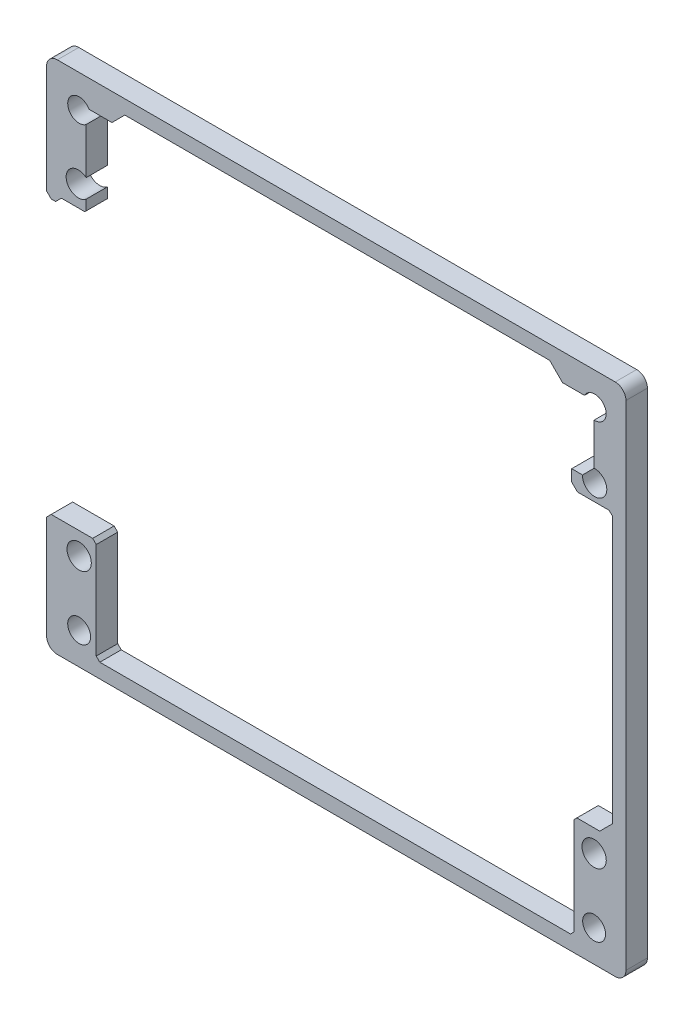
from build123d import *

# Parameters (mm, degrees)
MODEL_R                 = 1.600279216
MODEL_R_2               = 1.7
SALIENTE_EXTRUIR2_DEPTH = 3


with BuildPart() as part:
    # Model → Saliente-Extruir2 (new body)
    with BuildSketch(Plane.XY):
        with BuildLine():
            Line((271.351226454, 245.262259879), (270.71262235, 244.623655775))
            Line((270.71262235, 244.623655775), (270.71262235, 230.233550186))
            ThreePointArc((270.71262235, 230.233550186), (271.151962178, 229.172890015), (272.21262235, 228.733550186))
            Line((272.21262235, 228.733550186), (350.217232207, 228.733550186))
            ThreePointArc((350.217232207, 228.733550186), (351.277892379, 229.172890015), (351.717232207, 230.233550186))
            Line((351.717232207, 230.233550186), (351.717232207, 299.235954421))
            ThreePointArc((351.717232208, 299.235954421), (351.277892379, 300.296614592), (350.217232207, 300.735954421))
            Line((350.217232207, 300.735954421), (272.21262235, 300.735954421))
            ThreePointArc((272.21262235, 300.735954421), (271.151962178, 300.296614592), (270.71262235, 299.235954421))
            Line((270.71262235, 299.235954421), (270.71262235, 284.103268217))
            Line((270.71262235, 284.103268217), (271.351226454, 283.464664113))
            Line((271.351226454, 283.464664113), (271.97853318, 283.464664113))
            Line((271.97853318, 283.464664113), (272.77853318, 284.264664113))
            Line((272.77853318, 284.264664113), (276.051226454, 284.264664113))
            Line((276.051226454, 284.264664113), (276.251226454, 284.464664114))
            Line((276.251226454, 284.464664114), (276.251226454, 285.894852324))
            ThreePointArc((276.251226454, 285.894852324), (273.443758266, 287.176917482), (276.239508411, 288.48433854))
            Line((276.239508411, 288.48433854), (276.239508411, 294.917021597))
            ThreePointArc((276.239508411, 294.917021597), (273.696009795, 296.507802753), (276.661013605, 296.964664113))
            Line((276.661013605, 296.964664113), (279.851226454, 296.964664113))
            Line((279.851226454, 296.964664113), (281.651226454, 298.764664113))
            Line((281.651226454, 298.764664113), (341.055836311, 298.764664113))
            Line((341.055836311, 298.764664113), (342.855836311, 296.964664113))
            Line((342.855836311, 296.964664113), (345.9273642, 296.964664113))
            ThreePointArc((345.9273642, 296.964664113), (348.738416986, 297.034405979), (347.268369224, 294.637357529))
            Line((347.268369224, 294.637357529), (347.268369224, 288.812692031))
            ThreePointArc((347.268369224, 288.812692031), (348.543864828, 285.912196427), (345.643369224, 287.187692032))
            Line((345.643369224, 287.187692032), (344.134568969, 287.187692032))
            Line((344.134568969, 287.187692032), (344.134568969, 285.564664113))
            Line((344.134568969, 285.564664113), (344.934568969, 284.764664113))
            Line((344.934568969, 284.764664113), (349.36625565, 284.764664113))
            Line((349.36625565, 284.764664113), (349.86625565, 284.264664113))
            Line((349.86625565, 284.264664113), (349.86625565, 247.072679218))
            Line((349.86625565, 247.072679218), (348.055836311, 245.262259879))
            Line((348.055836311, 245.262259879), (344.855836311, 245.262259879))
            Line((344.855836311, 245.262259879), (344.468087014, 244.877634885))
            Line((344.468087014, 244.877634885), (344.468087014, 231.262259879))
            Line((344.468087014, 231.262259879), (343.968087014, 230.762259879))
            Line((343.968087014, 230.762259879), (278.151226454, 230.762259879))
            Line((278.151226454, 230.762259879), (277.651226454, 231.262259879))
            Line((277.651226454, 231.262259879), (277.651226454, 244.762259879))
            Line((277.651226454, 244.762259879), (277.151226454, 245.262259879))
            Line((277.151226454, 245.262259879), (271.351226454, 245.262259879))
        make_face()
        with Locations((275.263424864, 233.182413169)):
            Circle(MODEL_R, mode=Mode.SUBTRACT)
        with Locations((275.263424864, 242.182078667)):
            Circle(MODEL_R_2, mode=Mode.SUBTRACT)
        with Locations((347.268369224, 233.182413169)):
            Circle(MODEL_R, mode=Mode.SUBTRACT)
        with Locations((347.268369224, 242.182078667)):
            Circle(MODEL_R_2, mode=Mode.SUBTRACT)
    extrude(amount=SALIENTE_EXTRUIR2_DEPTH)


solid = part.part
